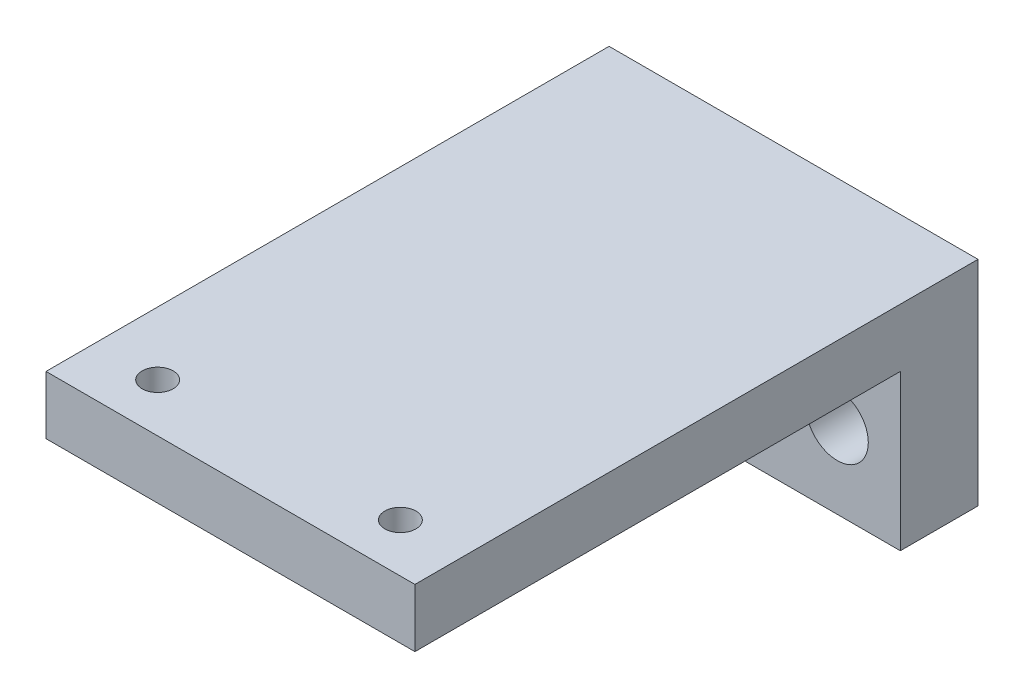
from build123d import *

# Parameters (mm, degrees)
SKETCH_1_W          = 38
SKETCH_1_H          = 38
EXTRUDE_1_DEPTH     = 8
SKETCH_2_W          = 38
SKETCH_2_H          = 6
EXTRUDE_2_DEPTH     = 50
SKETCH_3_W          = 38
SKETCH_3_H          = 16
CUT_EXTRUDE_1_DEPTH = 10
SKETCH_4_R          = 3.2
CUT_EXTRUDE_2_DEPTH = 10
SKETCH_5_R          = 1.6
CUT_EXTRUDE_3_DEPTH = 10


with BuildPart() as part:
    # 草图1 → 拉伸1 (new body)
    with BuildSketch(Plane.XY):
        with Locations((-0.319940249, 13.481833206)):
            Rectangle(SKETCH_1_W, SKETCH_1_H)
    extrude(amount=EXTRUDE_1_DEPTH)

    # 草图2 → 拉伸2 (add)
    with BuildSketch(Plane.XY.offset(8)):
        with Locations((-0.319940249, 29.481833206)):
            Rectangle(SKETCH_2_W, SKETCH_2_H)
    extrude(amount=EXTRUDE_2_DEPTH)

    # 草图3 → 切除-拉伸1 (cut)
    with BuildSketch(Plane.XY.offset(8)):
        with Locations((-0.319940249, 2.481833206)):
            Rectangle(SKETCH_3_W, SKETCH_3_H)
    extrude(amount=-CUT_EXTRUDE_1_DEPTH, mode=Mode.SUBTRACT)

    # 草图4 → 切除-拉伸2 (cut)
    with BuildSketch(Plane.XY.offset(8)):
        with Locations((-12.819940249, 18.481833206)):
            Circle(SKETCH_4_R)
        with Locations((12.180059751, 18.481833206)):
            Circle(SKETCH_4_R)
    extrude(amount=-CUT_EXTRUDE_2_DEPTH, mode=Mode.SUBTRACT)

    # 草图5 → 切除-拉伸3 (cut)
    with BuildSketch(Plane.XZ.offset(-26.481833206)):
        with Locations(Location((12.180059751, 53, 0), (0, 0, 270))):
            Circle(SKETCH_5_R)
        with Locations(Location((-12.819940249, 53, 0), (0, 0, 270))):
            Circle(SKETCH_5_R)
    extrude(amount=-CUT_EXTRUDE_3_DEPTH, mode=Mode.SUBTRACT)


solid = part.part
